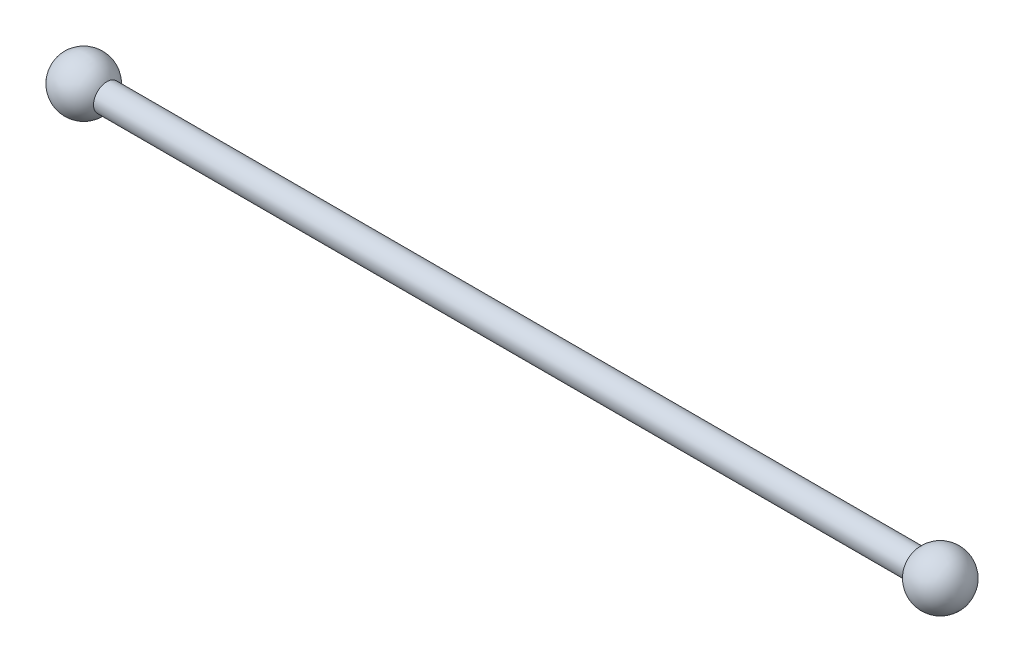
from build123d import *


with BuildPart() as part:
    # Sketch1 → Revolve2 (revolve)
    with BuildSketch(Plane.XY):
        with BuildLine():
            Line((42.5, 0), (-42.5, 0))
            ThreePointArc((-42.5, 0), (-40.647047613, 2.414814566), (-37.834936491, 1.25))
            Line((-37.834936491, 1.25), (37.834936491, 1.25))
            ThreePointArc((37.834936491, 1.25), (40.647047613, 2.414814566), (42.5, 0))
        make_face()
    revolve(axis=Axis((0, 0, 0), (-1, 0, 0)))


solid = part.part
